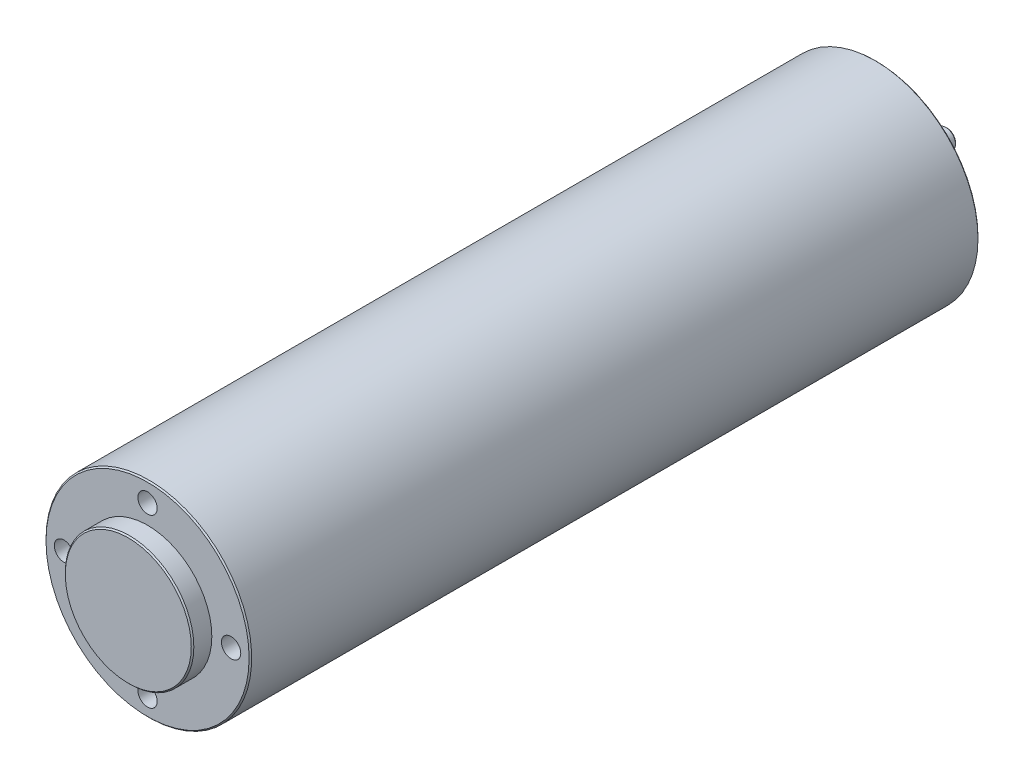
from build123d import *

# Parameters (mm, degrees)
CROQUIS1_R              = 16
SALIENTE_EXTRUIR1_DEPTH = 113.4
CROQUIS2_R              = 10
SALIENTE_EXTRUIR2_DEPTH = 3
CROQUIS3_R              = 6
SALIENTE_EXTRUIR3_DEPTH = 2
CROQUIS4_R              = 1.5
SALIENTE_EXTRUIR4_DEPTH = 9
CHAFL_N1_SIZE           = 0.2
CROQUIS5_R              = 1.5
CORTAR_EXTRUIR1_DEPTH   = 4


with BuildPart() as part:
    # Croquis1 → Saliente-Extruir1 (new body)
    with BuildSketch(Plane.XY):
        with Locations(Location((0, 0, 0), (0, 0, 180))):
            Circle(CROQUIS1_R)
    extrude(amount=SALIENTE_EXTRUIR1_DEPTH)

    # Croquis2 → Saliente-Extruir2 (add)
    with BuildSketch(Plane.XY.offset(113.4)):
        Circle(CROQUIS2_R)
    extrude(amount=SALIENTE_EXTRUIR2_DEPTH)

    # Croquis3 → Saliente-Extruir3 (add)
    with BuildSketch(Plane(origin=(0, 0, 0), x_dir=(-1, 0, 0), z_dir=(0, 0, -1))):
        Circle(CROQUIS3_R)
    extrude(amount=SALIENTE_EXTRUIR3_DEPTH)

    # Croquis4 → Saliente-Extruir4 (add)
    with BuildSketch(Plane(origin=(0, 0, -2), x_dir=(-1, 0, 0), z_dir=(0, 0, -1))):
        Circle(CROQUIS4_R)
    extrude(amount=SALIENTE_EXTRUIR4_DEPTH)

    # Chaflán1
    chafl_n1_edges = [part.edges().sort_by_distance(p)[0] for p in [
        (6, 0, -2),
        (1.5, 0, -11),
        (16, 0, 0),
        (16, 0, 113.4),
        (-10, 0, 116.4),
    ]]
    chamfer(chafl_n1_edges, length=CHAFL_N1_SIZE)

    # Croquis5 → Cortar-Extruir1 (cut)
    with BuildSketch(Plane.XY.offset(113.4)):
        with Locations((0, 13)):
            Circle(CROQUIS5_R)
        with Locations((13, 0)):
            Circle(CROQUIS5_R)
        with Locations((0, -13)):
            Circle(CROQUIS5_R)
        with Locations((-13, 0)):
            Circle(CROQUIS5_R)
    extrude(amount=-CORTAR_EXTRUIR1_DEPTH, mode=Mode.SUBTRACT)


solid = part.part
